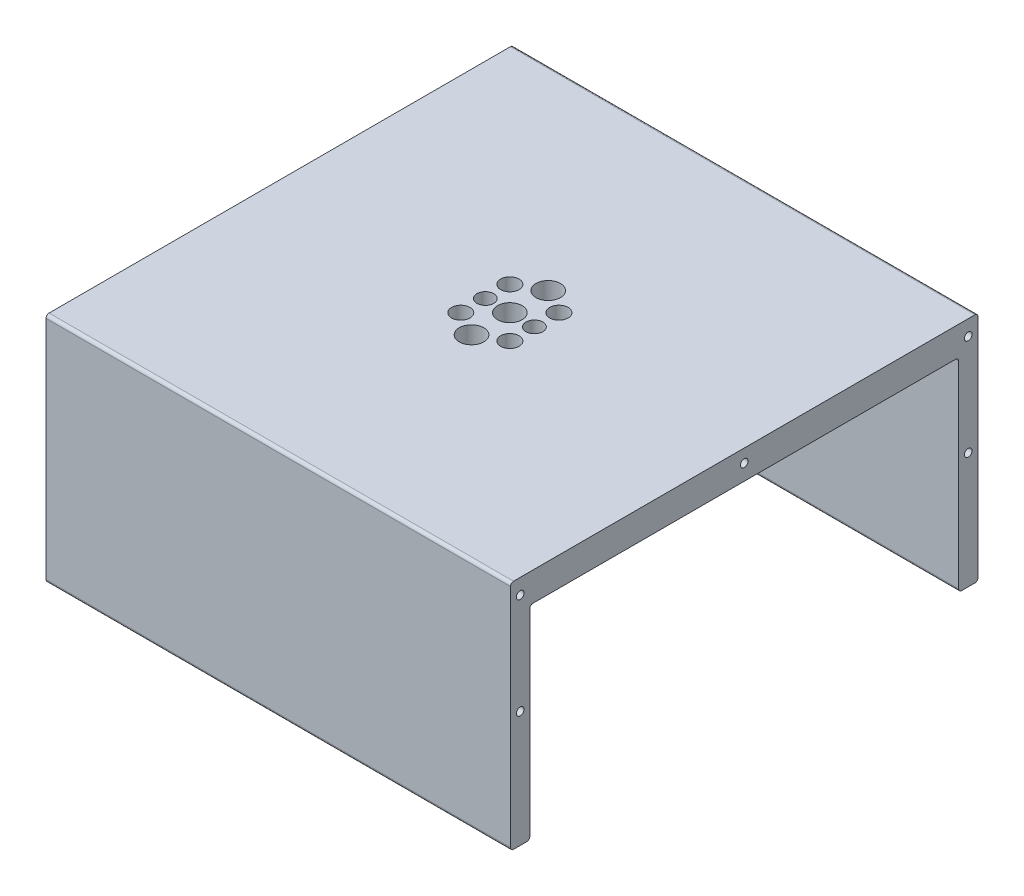
from build123d import *

# Parameters (mm, degrees)
BOSS_EXTRUDE1_DEPTH        = 151.4
F_12_0_12_DIAMETER_HOLE1_D = 8
F_10_0_10_DIAMETER_HOLE1_D = 8
M3_TAPPED_HOLE1_D          = 2.5
M3_TAPPED_HOLE1_DEPTH      = 7.5
M3_TAPPED_HOLE1_TIP        = 0.751075774
M5_CLEARANCE_HOLE1_D       = 5.5
SKETCH19_R                 = 3
CUT_EXTRUDE3_DEPTH         = 186.631058824


with BuildPart() as part:
    # Sketch1 → Boss-Extrude1 (new body)
    with BuildSketch(Plane(origin=(0, 0, 0), x_dir=(0, 0, -1), z_dir=(1, 0, 0))):
        with BuildLine():
            Line((-69.9, -36.85), (-69.9, 27.45))
            ThreePointArc((-69.9, 27.45), (-69.607106781, 28.157106781), (-68.9, 28.45))
            Line((-68.9, 28.45), (68.9, 28.45))
            ThreePointArc((68.9, 28.45), (69.607106781, 28.157106781), (69.9, 27.45))
            Line((69.9, 27.45), (69.9, -36.85))
            ThreePointArc((69.9, -36.85), (70.192893219, -37.557106781), (70.9, -37.85))
            Line((70.9, -37.85), (75.2, -37.85))
            ThreePointArc((75.2, -37.85), (75.907106781, -37.557106781), (76.2, -36.85))
            Line((76.2, -36.85), (76.2, 36.85))
            ThreePointArc((76.2, 36.85), (75.907106781, 37.557106781), (75.2, 37.85))
            Line((75.2, 37.85), (-75.2, 37.85))
            ThreePointArc((-75.2, 37.85), (-75.907106781, 37.557106781), (-76.2, 36.85))
            Line((-76.2, 36.85), (-76.2, -36.85))
            ThreePointArc((-76.2, -36.85), (-75.907106781, -37.557106781), (-75.2, -37.85))
            Line((-75.2, -37.85), (-70.9, -37.85))
            ThreePointArc((-70.9, -37.85), (-70.192893219, -37.557106781), (-69.9, -36.85))
        make_face()
    extrude(amount=BOSS_EXTRUDE1_DEPTH)

    # Ø12.0 (12) Diameter Hole1 (through all)
    with Locations(Plane(origin=(0, 37.85, 0), x_dir=(1, 0, 0), z_dir=(0, 1, 0))):
        with Locations((75, 0)):
            Hole(F_12_0_12_DIAMETER_HOLE1_D / 2)

    # Ø10.0 (10) Diameter Hole1 (through all)
    with Locations(Plane(origin=(0, 37.85, 0), x_dir=(1, 0, 0), z_dir=(0, 1, 0))):
        with Locations((75, -12.5), (75, 0), (75, 12.5)):
            Hole(F_10_0_10_DIAMETER_HOLE1_D / 2)

    # M3 Tapped Hole1
    with Locations(Plane(origin=(151.4, 0, 0), x_dir=(0, 0, -1), z_dir=(1, 0, 0))):
        with Locations((-73.025, 0), (-73.025, 32.85), (0, 33.575019096), (73.025, 0), (73.025, 32.85)):
            Hole(M3_TAPPED_HOLE1_D / 2, depth=M3_TAPPED_HOLE1_DEPTH)
            with Locations((0, 0, -(M3_TAPPED_HOLE1_DEPTH + M3_TAPPED_HOLE1_TIP / 2))):  # 118° drill point
                Cone(0, M3_TAPPED_HOLE1_D / 2, M3_TAPPED_HOLE1_TIP, mode=Mode.SUBTRACT)

    # M5 Clearance Hole1 (through all)
    with Locations(Plane(origin=(0, 37.85, 0), x_dir=(1, 0, 0), z_dir=(0, 1, 0))):
        with Locations((83, 0), (67, 0)):
            Hole(M5_CLEARANCE_HOLE1_D / 2)

    # Sketch19 → Cut-Extrude3 (cut, through all)
    with BuildSketch(Plane(origin=(0, 37.85, 0), x_dir=(1, 0, 0), z_dir=(0, 1, 0))):
        with Locations(Location((67, 8, 0), (0, 0, 270))):
            Circle(SKETCH19_R)
        with Locations(Location((83, 8, 0), (0, 0, 270))):
            Circle(SKETCH19_R)
        with Locations(Location((83, -8, 0), (0, 0, 270))):
            Circle(SKETCH19_R)
        with Locations(Location((67, -8, 0), (0, 0, 270))):
            Circle(SKETCH19_R)
    extrude(amount=-CUT_EXTRUDE3_DEPTH, mode=Mode.SUBTRACT)


solid = part.part
